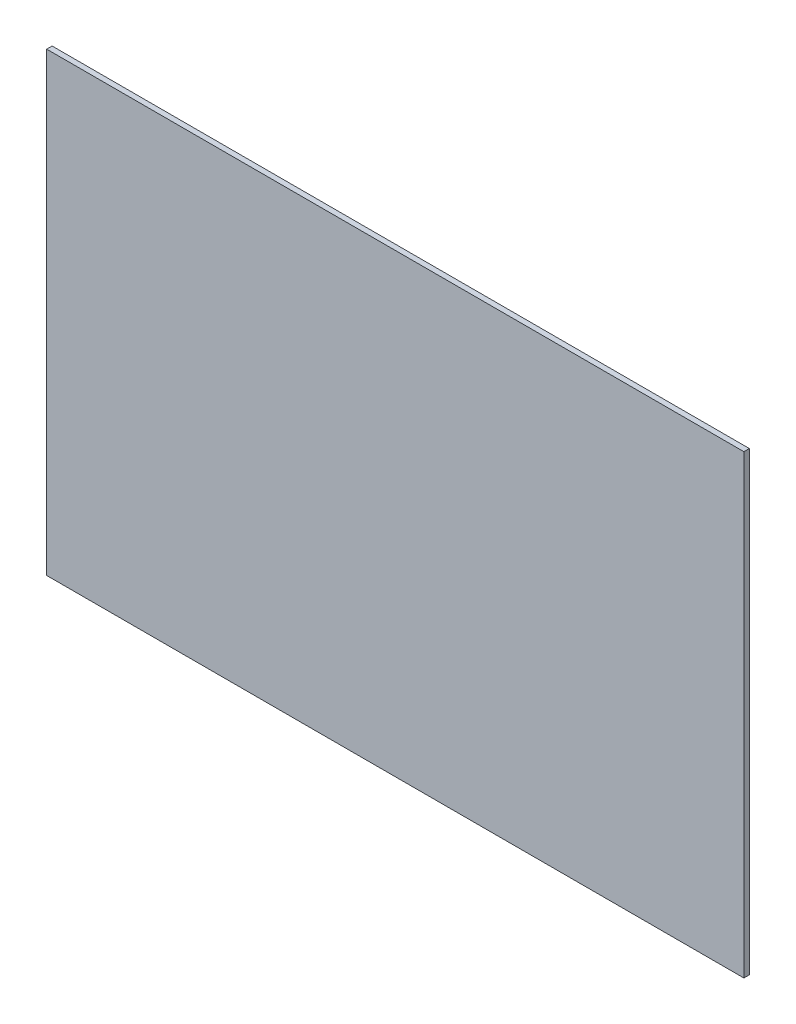
from build123d import *

# Parameters (mm, degrees)
ESQUISSE1_W        = 832
ESQUISSE1_H        = 544
BOSS_EXTRU_1_DEPTH = 6.5


with BuildPart() as part:
    # Esquisse1 → Boss.-Extru.1 (new body)
    with BuildSketch(Plane.XY):
        Rectangle(ESQUISSE1_W, ESQUISSE1_H)
    extrude(amount=BOSS_EXTRU_1_DEPTH)


solid = part.part
